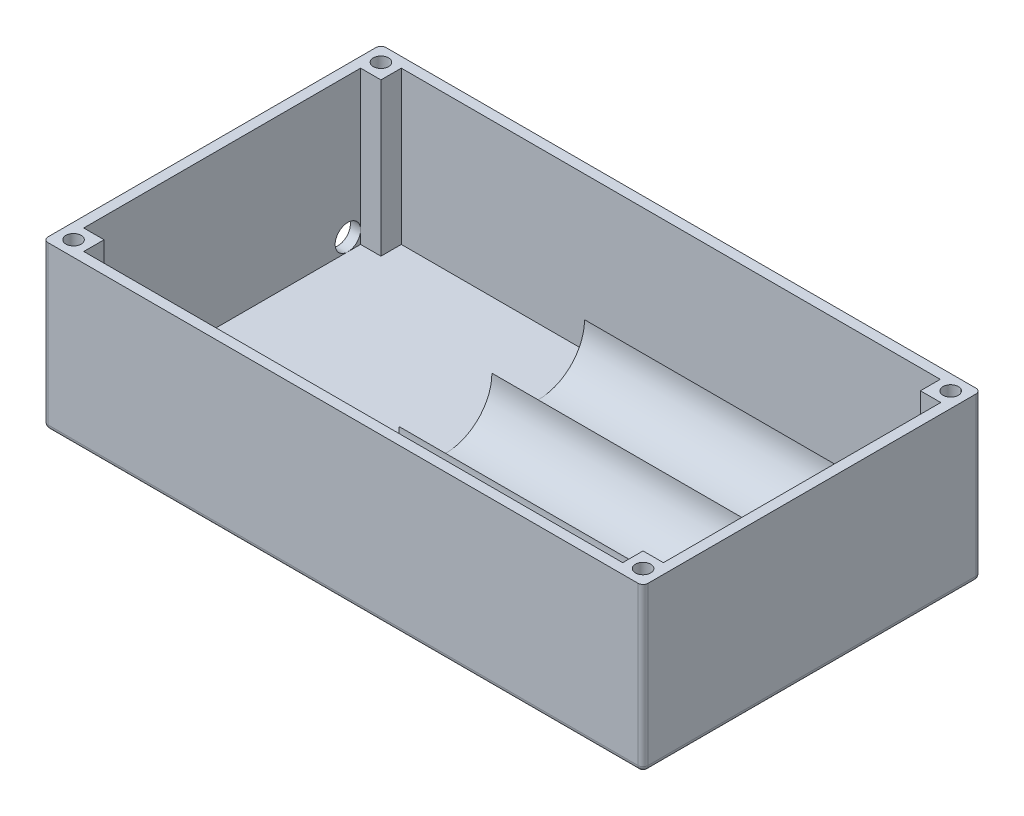
from build123d import *

# Parameters (mm, degrees)
SKETCH2_W               = 120
SKETCH2_H               = 70
BOSS_EXTRUDE1_DEPTH     = 30
SHELL1_T                = 2
CUT_EXTRUDE1_DEPTH      = 131.969462089
CUT_EXTRUDE1_DEPTH_BACK = 30
SKETCH3_R               = 2.5
BOSS_EXTRUDE2_DEPTH     = 70
CUT_EXTRUDE2_DEPTH      = 79.185676438
CUT_EXTRUDE2_DEPTH_BACK = 79.185676438
BOSS_EXTRUDE3_DEPTH     = 30
SKETCH7_W               = 3.836872944
SKETCH7_H               = 6.434844856
BOSS_EXTRUDE4_DEPTH     = 2
SKETCH8_R               = 2.5
CUT_EXTRUDE5_DEPTH      = 5
BOSS_EXTRUDE5_START     = -30
SKETCH10_W              = 6
SKETCH10_H              = 6
SKETCH10_H_2            = 5.9
BOSS_EXTRUDE5_DEPTH     = 30
SKETCH12_R              = 1.5
CUT_EXTRUDE6_DEPTH      = 15
FILLET2_R               = 1


with BuildPart() as part:
    # Sketch2 → Boss-Extrude1 (new body)
    with BuildSketch(Plane(origin=(0, 0, 0), x_dir=(1, 0, 0), z_dir=(0, 1, 0))):
        Rectangle(SKETCH2_W, SKETCH2_H)
    extrude(amount=BOSS_EXTRUDE1_DEPTH)

    # Shell1
    shell1_openings = [part.faces().sort_by_distance(p)[0] for p in [
        (0, 30, 0),
    ]]
    offset(amount=SHELL1_T, openings=shell1_openings, kind=Kind.INTERSECTION)

    # Sketch3 → Cut-Extrude1 (cut, two sides: drawn at the far end of the back side and taken through both)
    with BuildSketch(Plane(origin=(-60, 0, 0), x_dir=(0, 0, -1), z_dir=(1, 0, 0)).offset(-CUT_EXTRUDE1_DEPTH_BACK)):
        with Locations(Location((-28, 3, 0), (0, 0, 180))):
            Circle(SKETCH3_R)
    extrude(amount=CUT_EXTRUDE1_DEPTH + CUT_EXTRUDE1_DEPTH_BACK, mode=Mode.SUBTRACT)

    # Sketch4 → Boss-Extrude2 (add)
    with BuildSketch(Plane.ZY.offset(-60)):
        with BuildLine():
            ThreePointArc((-12.9, 9.1), (-15.565328291, 2.665328291), (-22, 0))
            Line((-22, 0), (-3.799999988, 0))
            ThreePointArc((-3.799999988, 0), (-10.234671705, 2.665328287), (-12.9, 9.1))
        make_face()
        with BuildLine():
            ThreePointArc((5.3, 9.1), (2.634671713, 2.665328295), (-3.799999988, 0))
            Line((-3.799999988, 0), (14.399999991, 0))
            ThreePointArc((14.399999991, 0), (7.965328288, 2.665328294), (5.3, 9.1))
        make_face()
        with BuildLine():
            ThreePointArc((23.5, 9.1), (20.834671706, 2.665328288), (14.399999991, 0))
            Line((14.399999991, 0), (23.5, 0))
            Line((23.5, 0), (23.5, 9.1))
        make_face()
        with BuildLine():
            ThreePointArc((-22, 0), (-28.434671709, 2.665328291), (-31.1, 9.1))
            Line((-31.1, 9.1), (-31.1, 0))
            Line((-31.1, 0), (-22, 0))
        make_face()
    extrude(amount=BOSS_EXTRUDE2_DEPTH)

    # Sketch5 → Cut-Extrude2 (cut, two sides: drawn at the far end of the back side and taken through both)
    with BuildSketch(Plane(origin=(0, 0, 0), x_dir=(1, 0, 0), z_dir=(0, 1, 0)).offset(-CUT_EXTRUDE2_DEPTH_BACK)):
        Polygon((-55.9, 39.544038894), (-55.9, -29.4), (62, -29.4), (62, -41.301551734), (-55.9, -41.301551734), (-67.058664884, -41.301551734), (-67.058664884, 39.544038894), align=None)
    extrude(amount=CUT_EXTRUDE2_DEPTH + CUT_EXTRUDE2_DEPTH_BACK, mode=Mode.SUBTRACT)

    # Sketch6 → Boss-Extrude3 (add)
    with BuildSketch(Plane(origin=(0, 0, 0), x_dir=(1, 0, 0), z_dir=(0, 1, 0))):
        Polygon((-55.9, 35), (-55.9, -29.4), (62, -29.4), (62, -27.4), (-53.9, -27.4), (-53.9, 35), align=None)
    extrude(amount=BOSS_EXTRUDE3_DEPTH)

    # Sketch7 → Boss-Extrude4 (add)
    with BuildSketch(Plane(origin=(62, 0, 0), x_dir=(0, 0, -1), z_dir=(1, 0, 0))):
        with Locations((-26.496817491, 3.217422428)):
            Rectangle(SKETCH7_W, SKETCH7_H)
    extrude(amount=-BOSS_EXTRUDE4_DEPTH)

    # Sketch8 → Cut-Extrude5 (cut)
    with BuildSketch(Plane(origin=(-53.9, 0, 0), x_dir=(0, 0, -1), z_dir=(1, 0, 0))):
        with Locations((28.5, 2.5)):
            Circle(SKETCH8_R)
    extrude(amount=-CUT_EXTRUDE5_DEPTH, mode=Mode.SUBTRACT)

    # Sketch10 → Boss-Extrude5 (add)
    with BuildSketch(Plane(origin=(0, 30, 0), x_dir=(1, 0, 0), z_dir=(0, 1, 0)).offset(BOSS_EXTRUDE5_START)):
        with Locations((-52.9, 34)):
            Rectangle(SKETCH10_W, SKETCH10_H)
        with Locations((-52.9, -26.4)):
            Rectangle(SKETCH10_W, SKETCH10_H)
        with Locations((59, 34.05)):
            Rectangle(SKETCH10_W, SKETCH10_H_2)
        with Locations((59, -26.4)):
            Rectangle(SKETCH10_W, SKETCH10_H)
    extrude(amount=BOSS_EXTRUDE5_DEPTH)

    # Sketch12 → Cut-Extrude6 (cut)
    with BuildSketch(Plane(origin=(0, 30, 0), x_dir=(1, 0, 0), z_dir=(0, 1, 0))):
        with Locations(Location((-52.9, 34, 0), (0, 0, 270))):
            Circle(SKETCH12_R)
        with Locations(Location((59, 34.05, 0), (0, 0, 270))):
            Circle(SKETCH12_R)
        with Locations(Location((59, -26.4, 0), (0, 0, 270))):
            Circle(SKETCH12_R)
        with Locations(Location((-52.9, -26.4, 0), (0, 0, 270))):
            Circle(SKETCH12_R)
    extrude(amount=-CUT_EXTRUDE6_DEPTH, mode=Mode.SUBTRACT)

    # Fillet2
    fillet2_edges = [part.edges().sort_by_distance(p)[0] for p in [
        (-55.9, -2, -3.8),
        (-55.9, 14, -37),
        (62, 14, 29.4),
        (3.05, -2, 29.4),
        (-55.9, 14, 29.4),
        (3.05, -2, -37),
        (62, 14, -37),
        (62, -2, -3.8),
    ]]
    fillet(fillet2_edges, radius=FILLET2_R)


solid = part.part
